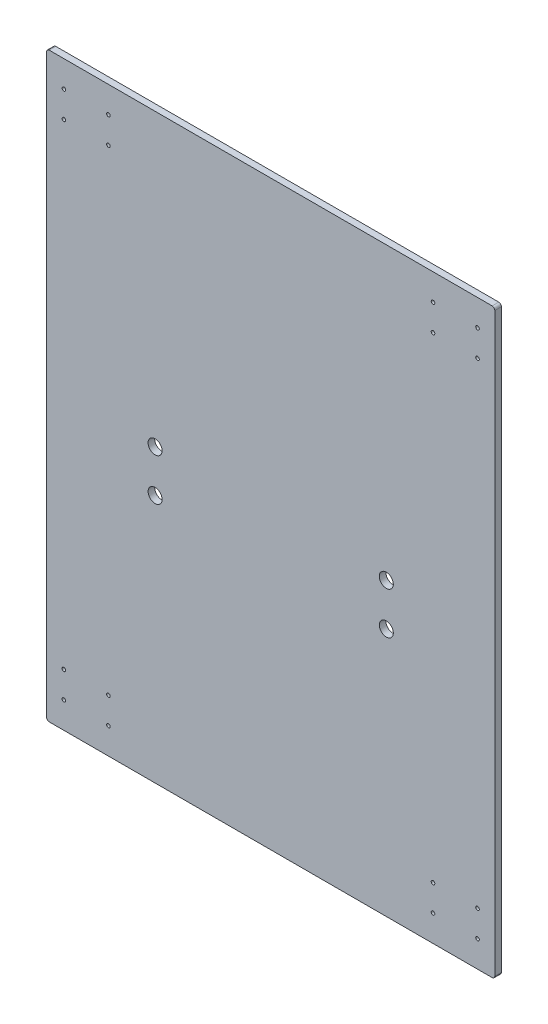
from build123d import *

# Parameters (mm, degrees)
SKETCH1_W               = 431.8
SKETCH1_H               = 560.466887406
BOSS_EXTRUDE1_DEPTH     = 6.35
FILLET1_R               = 2.54
F_1_2_CLEARANCE_HOLE1_D = 13.49248
F_5_CLEARANCE_HOLE1_D   = 3.4544


with BuildPart() as part:
    # Sketch1 → Boss-Extrude1 (new body)
    with BuildSketch(Plane.XY):
        with Locations((177.8, -242.133443703)):
            Rectangle(SKETCH1_W, SKETCH1_H)
    extrude(amount=BOSS_EXTRUDE1_DEPTH)

    # Fillet1
    fillet1_edges = [part.edges().sort_by_distance(p)[0] for p in [
        (-38.1, 38.1, 3.175),
        (393.7, 38.1, 3.175),
        (393.7, -522.366887406, 3.175),
        (-38.1, -522.366887406, 3.175),
    ]]
    fillet(fillet1_edges, radius=FILLET1_R)

    # 1/2 Clearance Hole1 (through all)
    with Locations(Plane(origin=(0, 0, 0), x_dir=(-1, 0, 0), z_dir=(0, 0, -1))):
        with Locations((-66.42862, -241.82), (-289.17138, -241.82), (-289.17138, -282.46), (-66.42862, -282.46)):
            Hole(F_1_2_CLEARANCE_HOLE1_D / 2)

    # #5 Clearance Hole1 (through all)
    with Locations(Plane(origin=(0, 0, 0), x_dir=(-1, 0, 0), z_dir=(0, 0, -1))):
        with Locations((-377.0376, 12.7), (-377.0376, -12.7), (-334.1624, 12.7), (-334.1624, -12.7), (-21.4376, -12.7), (21.4376, -12.7), (21.4376, 12.7), (-21.4376, 12.7), (-21.4376, -496.966887406), (21.4376, -496.966887406), (21.4376, -471.566887406), (-21.4376, -471.566887406), (-334.1624, -471.566887406), (-334.1624, -496.966887406), (-377.0376, -471.566887406), (-377.0376, -496.966887406)):
            Hole(F_5_CLEARANCE_HOLE1_D / 2)


solid = part.part
